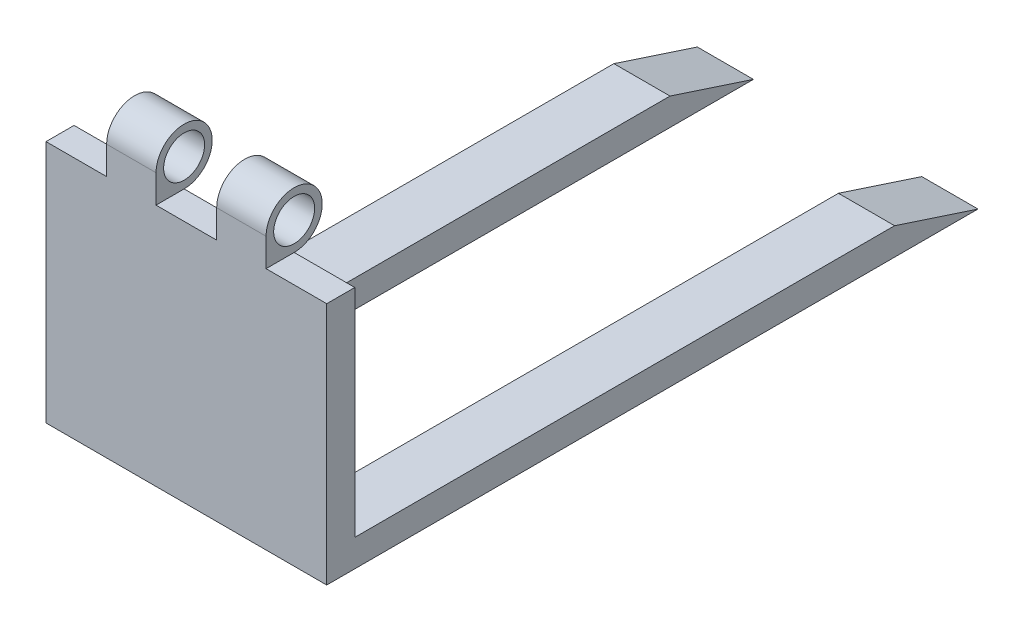
from build123d import *

# Parameters (mm, degrees)
SKETCH1_W               = 6.35
SKETCH1_H               = 61.468
BOSS_EXTRUDE1_DEPTH     = 31.75
BOSS_EXTRUDE2_DEPTH     = 12.7
SKETCH7_R               = 6.35
SKETCH8_R               = 4.6355
CUT_EXTRUDE1_DEPTH      = 169.831490025
CUT_EXTRUDE2_DEPTH      = 166.258966546
CUT_EXTRUDE2_DEPTH_BACK = 166.258966546
SKETCH12_W              = 13.716
SKETCH12_H              = 12.7


with BuildPart() as part:
    # Sketch1 → Boss-Extrude1 (new, symmetric)
    with BuildSketch(Plane(origin=(0, 0, 0), x_dir=(0, 0, -1), z_dir=(1, 0, 0))):
        with Locations((-3.175, 30.734)):
            Rectangle(SKETCH1_W, SKETCH1_H)
    extrude(amount=BOSS_EXTRUDE1_DEPTH, both=True)

    # Sketch4 → Boss-Extrude2 (add)
    with BuildSketch(Plane(origin=(31.75, 0, 0), x_dir=(0, 0, -1), z_dir=(1, 0, 0))):
        Polygon((-6.35, 0), (140.97, 0), (122.101981581, 6.168018419), (-6.35, 6.168018419), align=None)
    boss_extrude2 = extrude(amount=-BOSS_EXTRUDE2_DEPTH)

    # Mirror1: Boss-Extrude2 across plane
    add(boss_extrude2.mirror(Plane(origin=(0, 0, 0), x_dir=(0, 0, 1), z_dir=(1, 0, 0))))

    # Sweep1: sweep along a curve in space
    with BuildLine() as sweep1_path:
        Line((31.75, 61.468, 0), (-31.75, 61.468, 0))
    # Sketch7 → Sweep1 (sweep)
    with BuildSketch(Plane(origin=(31.75, 0, 0), x_dir=(0, 0, -1), z_dir=(1, 0, 0))):
        with Locations((0, 61.468)):
            Circle(SKETCH7_R)
    sweep(path=sweep1_path.line)

    # Sketch8 → Cut-Extrude1 (cut, through all)
    with BuildSketch(Plane(origin=(31.75, 0, 0), x_dir=(0, 0, -1), z_dir=(1, 0, 0))):
        with Locations((0, 61.468)):
            Circle(SKETCH8_R)
    extrude(amount=-CUT_EXTRUDE1_DEPTH, mode=Mode.SUBTRACT)

    # Sketch12 → Cut-Extrude2 (cut, two sides: drawn at the far end of the back side and taken through both)
    with BuildSketch(Plane.XY.offset(6.35).offset(-CUT_EXTRUDE2_DEPTH_BACK)):
        with Locations((-24.892, 61.468)):
            Rectangle(SKETCH12_W, SKETCH12_H)
        with Locations((24.892, 61.468)):
            Rectangle(SKETCH12_W, SKETCH12_H)
        with Locations((0, 61.468)):
            Rectangle(SKETCH12_W, SKETCH12_H)
    extrude(amount=CUT_EXTRUDE2_DEPTH + CUT_EXTRUDE2_DEPTH_BACK, mode=Mode.SUBTRACT)


solid = part.part
